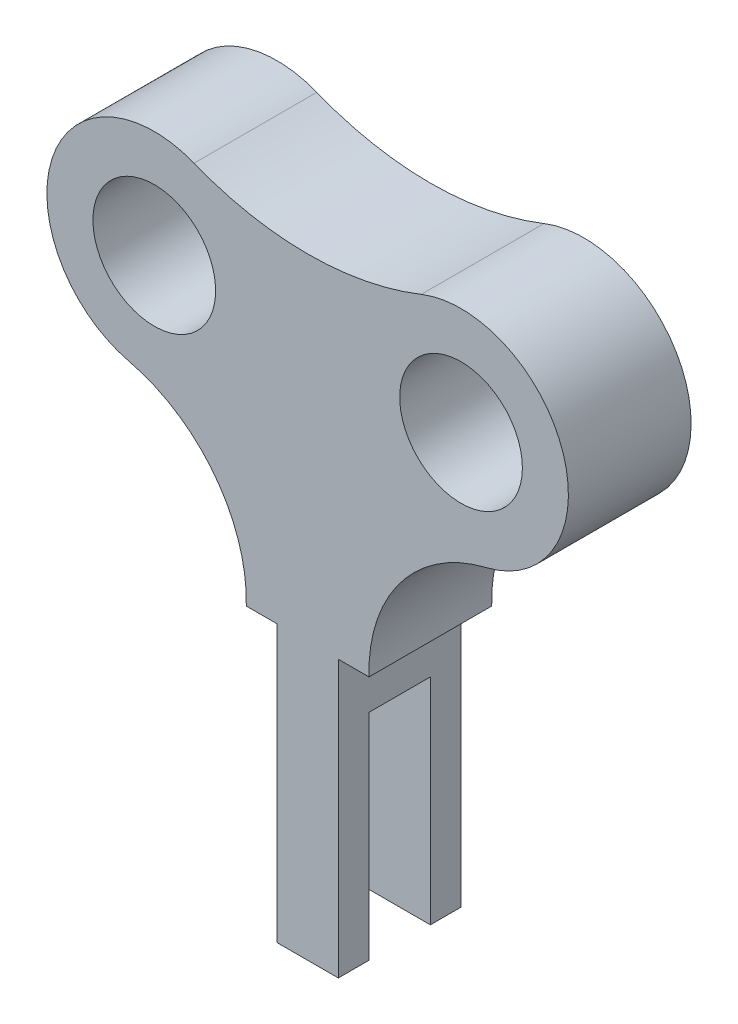
from build123d import *

# Parameters (mm, degrees)
SKETCH1_R           = 10
BOSS_EXTRUDE1_DEPTH = 10
SKETCH2_W           = 10
SKETCH2_H           = 35
CUT_EXTRUDE1_DEPTH  = 10


with BuildPart() as part:
    # Sketch1 → Boss-Extrude1 (new, symmetric)
    with BuildSketch(Plane.XY):
        with BuildLine():
            Line((5, 22.5), (10, 22.5))
            ThreePointArc((10, 22.5), (15.132819854, 38.37888203), (29.113715132, 47.490374848))
            ThreePointArc((29.113715132, 47.490374848), (41.674629404, 69.811001246), (18.518518519, 80.755472857))
            ThreePointArc((18.518518519, 80.755472857), (0, 77.19968102), (-18.518518519, 80.755472857))
            ThreePointArc((-18.518518519, 80.755472857), (-41.674629404, 69.811001246), (-29.113715132, 47.490374848))
            ThreePointArc((-29.113715132, 47.490374848), (-15.132819854, 38.37888203), (-10, 22.5))
            Line((-10, 22.5), (-5, 22.5))
            Line((-5, 22.5), (-5, -22.5))
            Line((-5, -22.5), (5, -22.5))
            Line((5, -22.5), (5, 22.5))
        make_face()
        with Locations((25, 64.5)):
            Circle(SKETCH1_R, mode=Mode.SUBTRACT)
        with Locations(Location((-25, 64.5, 0), (0, 0, 180))):
            Circle(SKETCH1_R, mode=Mode.SUBTRACT)
    extrude(amount=BOSS_EXTRUDE1_DEPTH, both=True)

    # Sketch2 → Cut-Extrude1 (cut)
    with BuildSketch(Plane.ZY.offset(5)):
        with Locations((0, -5)):
            Rectangle(SKETCH2_W, SKETCH2_H)
    extrude(amount=-CUT_EXTRUDE1_DEPTH, mode=Mode.SUBTRACT)


solid = part.part
